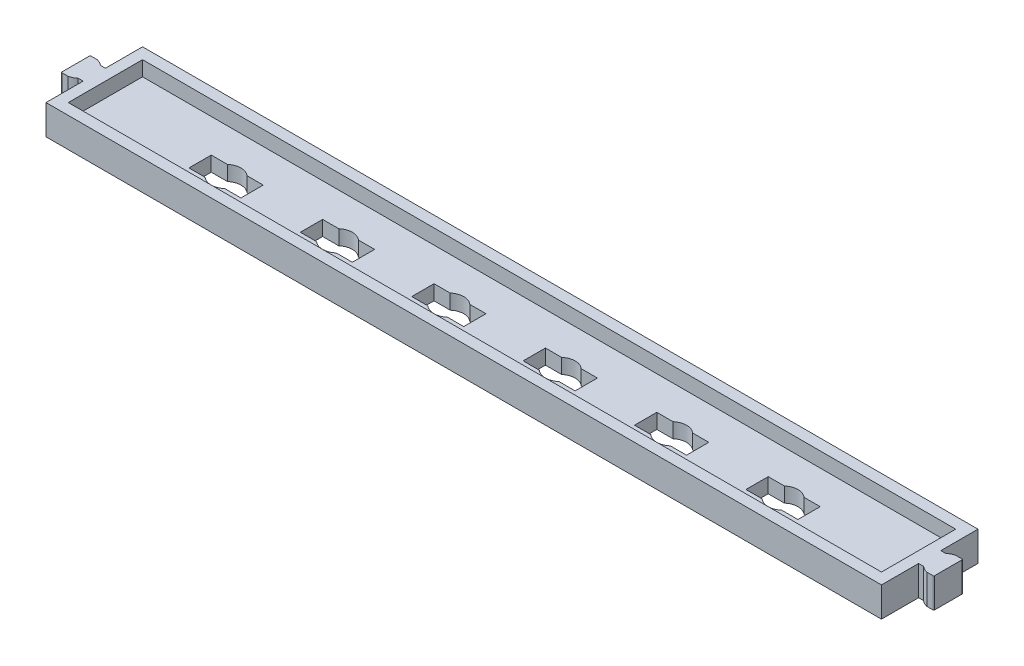
from build123d import *

# Parameters (mm, degrees)
SKETCH_1_W                 = 112.5
SKETCH_1_H                 = 13
EXTRUDE_1_DEPTH            = 4
EXTRUDE_2_DEPTH            = 4
SKETCH_3_W                 = 109.5
SKETCH_3_H                 = 10
CUT_EXTRUDE_1_DEPTH        = 2
CUT_EXTRUDE_2_REACH        = 61.142
PATTERN_LINEAR_1_COUNT     = 4
PATTERN_LINEAR_1_PITCH     = 15
PATTERN_LINEAR_1_COL_COUNT = 3
PATTERN_LINEAR_1_COL_PITCH = 15
FILLET_1_R                 = 0.1


with BuildPart() as part:
    # 草图1 → 凸台-拉伸1 (new body)
    with BuildSketch(Plane(origin=(0, 0, 0), x_dir=(1, 0, 0), z_dir=(0, 1, 0))):
        Rectangle(SKETCH_1_W, SKETCH_1_H)
    extrude(amount=EXTRUDE_1_DEPTH)

    # 草图2 → 凸台-拉伸2 (add)
    with BuildSketch(Plane.XZ):
        with BuildLine():
            Line((56.25, -1.5), (56.25, 1.5))
            Line((56.25, 1.5), (56.927124344, 1.5))
            ThreePointArc((56.927124344, 1.5), (57.338161527, 1.780042303), (57.805590279, 1.95))
            Line((57.805590279, 1.95), (58.75, 1.95))
            Line((58.75, 1.95), (58.75, -1.95))
            Line((58.75, -1.95), (57.805590279, -1.95))
            ThreePointArc((57.805590279, -1.95), (57.338161527, -1.780042303), (56.927124344, -1.5))
            Line((56.927124344, -1.5), (56.25, -1.5))
        make_face()
    extrude_2 = extrude(amount=-EXTRUDE_2_DEPTH)

    # 镜向1: 凸台-拉伸2 across plane
    add(extrude_2.mirror(Plane(origin=(0, 0, 0), x_dir=(0, 0, 1), z_dir=(1, 0, 0))))

    # 草图3 → 切除-拉伸1 (cut)
    with BuildSketch(Plane(origin=(0, 4, 0), x_dir=(1, 0, 0), z_dir=(0, 1, 0))):
        Rectangle(SKETCH_3_W, SKETCH_3_H)
    extrude(amount=-CUT_EXTRUDE_1_DEPTH, mode=Mode.SUBTRACT)

    # 草图4 → 切除-拉伸2 (cut, up to next)
    with BuildSketch(Plane(origin=(0, 2, 0), x_dir=(1, 0, 0), z_dir=(0, 1, 0)), mode=Mode.PRIVATE) as cut_extrude_2_sk1:
        with BuildLine():
            Line((-4, -2.5), (-4, 0.5))
            Line((-4, 0.5), (-6.177124344, 0.5))
            ThreePointArc((-6.177124344, 0.5), (-7.5, 1), (-8.822875656, 0.5))
            Line((-8.822875656, 0.5), (-11, 0.5))
            Line((-11, 0.5), (-11, -2.5))
            Line((-11, -2.5), (-8.822875656, -2.5))
            ThreePointArc((-8.822875656, -2.5), (-7.5, -3), (-6.177124344, -2.5))
            Line((-6.177124344, -2.5), (-4, -2.5))
        make_face()
    cut_extrude_2_tool1 = extrude(cut_extrude_2_sk1.sketch, amount=-CUT_EXTRUDE_2_REACH, mode=Mode.PRIVATE) & part.part
    cut_extrude_2 = cut_extrude_2_tool1.solids().sort_by_distance((-7.5, 2, 1))[0]
    add(cut_extrude_2, mode=Mode.SUBTRACT)

    # 阵列(线性)1: 切除-拉伸2 ×4
    with Locations(*[(i * PATTERN_LINEAR_1_PITCH, 0, 0) for i in range(1, PATTERN_LINEAR_1_COUNT)]):
        add(cut_extrude_2, mode=Mode.SUBTRACT)

    # 阵列(线性)1 col: 切除-拉伸2 ×3
    with Locations(*[(-i * PATTERN_LINEAR_1_COL_PITCH, 0, 0) for i in range(1, PATTERN_LINEAR_1_COL_COUNT)]):
        add(cut_extrude_2, mode=Mode.SUBTRACT)

    # 圆角1
    fillet_1_edges = [part.edges().sort_by_distance(p)[0] for p in [
        (58.75, 2, -1.95),
        (58.75, 2, 1.95),
        (-58.75, 2, -1.95),
        (-58.75, 2, 1.95),
    ]]
    fillet(fillet_1_edges, radius=FILLET_1_R)


solid = part.part
